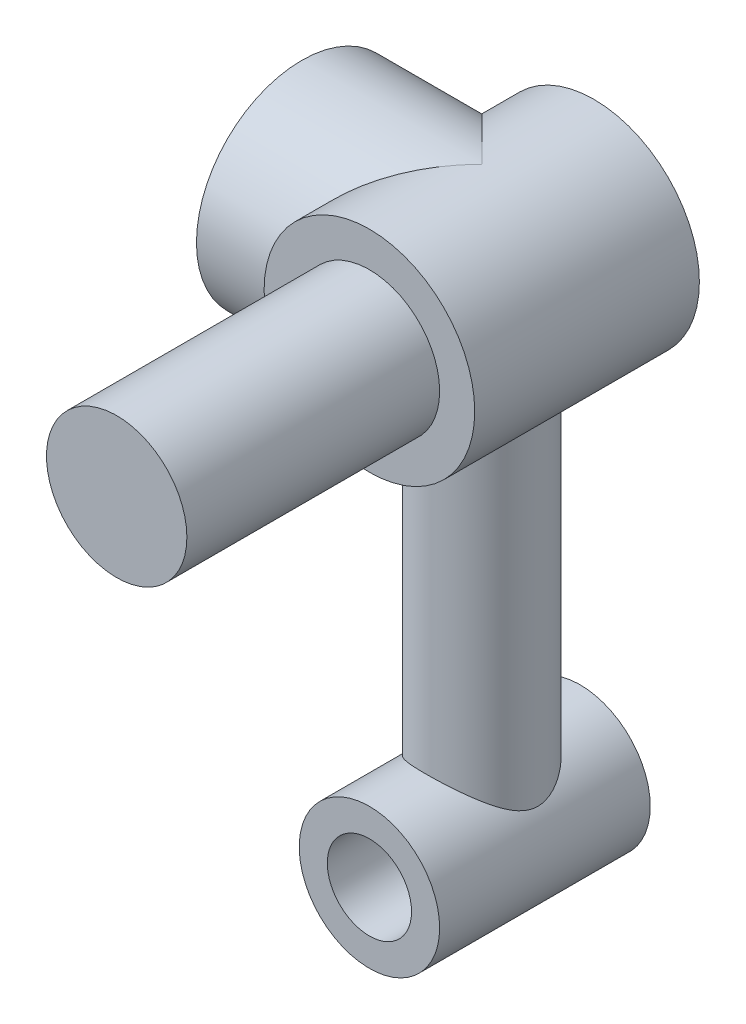
from build123d import *

# Parameters (mm, degrees)
SKETCH1_R           = 50
BOSS_EXTRUDE1_DEPTH = 180
SKETCH2_R           = 75
BOSS_EXTRUDE2_DEPTH = 160
SKETCH3_R           = 75
BOSS_EXTRUDE3_DEPTH = 128.18
SKETCH4_R           = 40
BOSS_EXTRUDE4_DEPTH = 300
SKETCH5_R           = 50
SKETCH5_R_2         = 30
BOSS_EXTRUDE5_DEPTH = 150


with BuildPart() as part:
    # Sketch1 → Boss-Extrude1 (new body)
    with BuildSketch(Plane.XY):
        with Locations((-700, 1796)):
            Circle(SKETCH1_R)
    extrude(amount=-BOSS_EXTRUDE1_DEPTH)

    # Sketch2 → Boss-Extrude2 (add)
    with BuildSketch(Plane(origin=(0, 0, -180), x_dir=(-1, 0, 0), z_dir=(0, 0, -1))):
        with Locations((700, 1796)):
            Circle(SKETCH2_R)
    extrude(amount=BOSS_EXTRUDE2_DEPTH)

    # Sketch3 → Boss-Extrude3 (add)
    with BuildSketch(Plane(origin=(-700, 0, 0), x_dir=(0, 0, -1), z_dir=(1, 0, 0))):
        with Locations((260, 1796)):
            Circle(SKETCH3_R)
    extrude(amount=-BOSS_EXTRUDE3_DEPTH)

    # Sketch4 → Boss-Extrude4 (add)
    with BuildSketch(Plane(origin=(0, 1795, 0), x_dir=(-1, 0, 0), z_dir=(0, 1, 0))):
        with Locations(Location((700, -260, 0), (0, 0, 90))):
            Circle(SKETCH4_R)
    extrude(amount=-BOSS_EXTRUDE4_DEPTH)

    # Sketch5 → Boss-Extrude5 (add)
    with BuildSketch(Plane.XY.offset(-180)):
        with Locations((-700, 1465)):
            Circle(SKETCH5_R)
        with Locations((-700, 1465)):
            Circle(SKETCH5_R_2, mode=Mode.SUBTRACT)
    extrude(amount=-BOSS_EXTRUDE5_DEPTH)


solid = part.part
